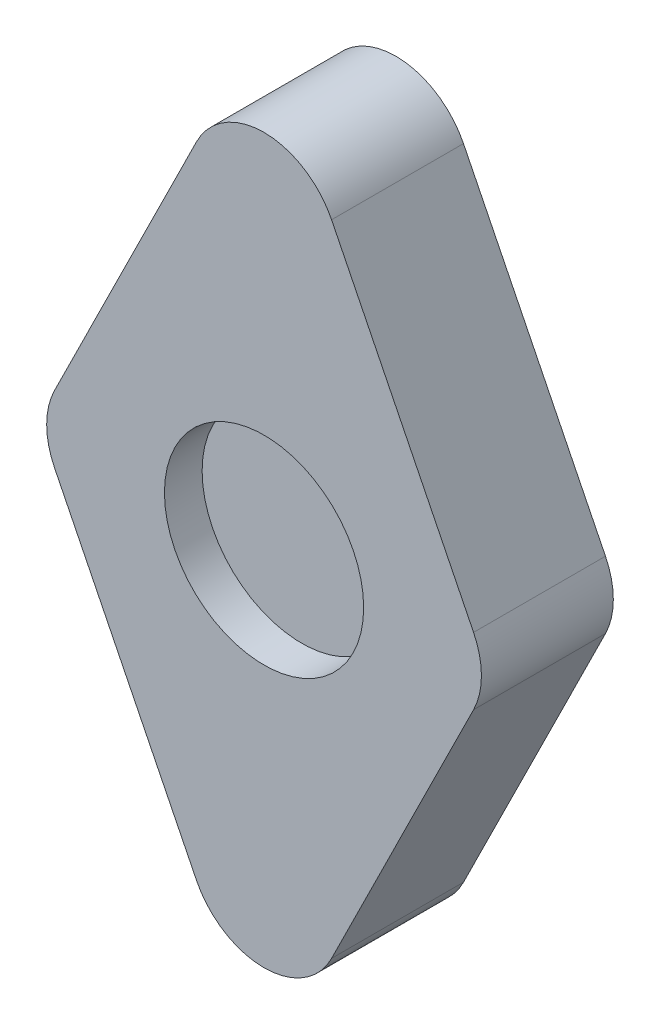
from build123d import *

# Parameters (mm, degrees)
BOSS_EXTRUDE1_DEPTH = 17.78
SKETCH2_R           = 13.426008181
CUT_EXTRUDE1_DEPTH  = 5.08
SCALE1_SCALE        = 1.5
SCALE2_SCALE        = 2
SKETCH3_R           = 25.4
CUT_EXTRUDE2_DEPTH  = 15.24


with BuildPart() as part:
    # Sketch1 → Boss-Extrude1 (new body)
    with BuildSketch(Plane.XY):
        with BuildLine():
            Line((-28.241863774, 4.513574723), (-9.102375691, 43.111542356))
            ThreePointArc((-9.102375691, 43.111542356), (0, 48.757967634), (9.102375691, 43.111542356))
            Line((9.102375691, 43.111542356), (28.241863774, 4.513574723))
            ThreePointArc((28.241863774, 4.513574723), (29.299488083, 0), (28.241863774, -4.513574723))
            Line((28.241863774, -4.513574723), (9.102375691, -43.111542356))
            ThreePointArc((9.102375691, -43.111542356), (0, -48.757967634), (-9.102375691, -43.111542356))
            Line((-9.102375691, -43.111542356), (-28.241863774, -4.513574723))
            ThreePointArc((-28.241863774, -4.513574723), (-29.299488083, 0), (-28.241863774, 4.513574723))
        make_face()
    extrude(amount=BOSS_EXTRUDE1_DEPTH)

    # Sketch2 → Cut-Extrude1 (cut)
    with BuildSketch(Plane.XY.offset(17.78)):
        Circle(SKETCH2_R)
    extrude(amount=-CUT_EXTRUDE1_DEPTH, mode=Mode.SUBTRACT)


with BuildPart() as part_1:
    # Scale1: scaled about (0, 0, 8.587002836)
    add(part.part.scale(SCALE1_SCALE).moved(Location((0, 0, -4.293501418))))


with BuildPart() as part_2:
    # Scale2: scaled about (0, 0, 8.587002836)
    add(part_1.part.scale(SCALE2_SCALE).moved(Location((0, 0, -8.587002836))))

    # Sketch3 → Cut-Extrude2 (cut)
    with BuildSketch(Plane(origin=(0, 0, -17.174005673), x_dir=(-1, 0, 0), z_dir=(0, 0, -1))):
        with Locations((-44.45, 0)):
            Circle(SKETCH3_R)
        with Locations((44.45, 0)):
            Circle(SKETCH3_R)
    extrude(amount=-CUT_EXTRUDE2_DEPTH, mode=Mode.SUBTRACT)


solid = part_2.part
